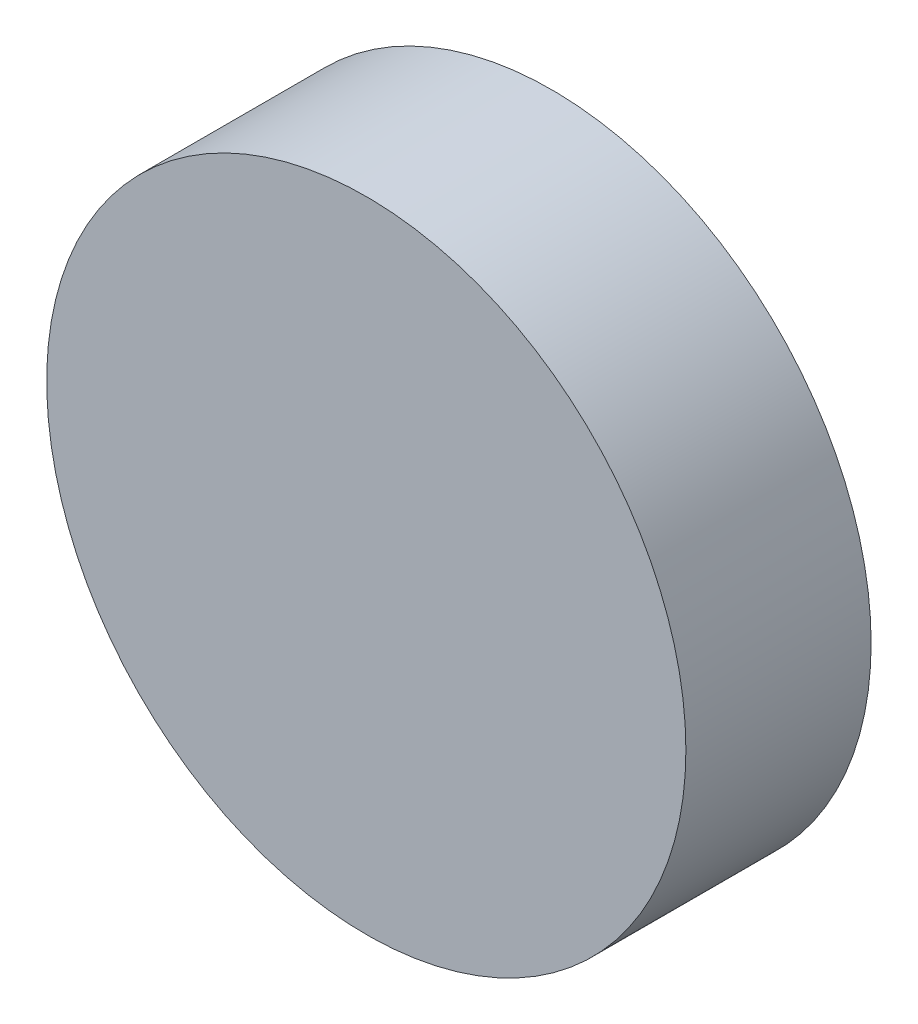
from build123d import *

# Parameters (mm, degrees)
ESQUISSE1_R        = 25.881763996
BOSS_EXTRU_1_DEPTH = 15


with BuildPart() as part:
    # Esquisse1 → Boss.-Extru.1 (new body)
    with BuildSketch(Plane.XY):
        Circle(ESQUISSE1_R)
    extrude(amount=BOSS_EXTRU_1_DEPTH)


solid = part.part
